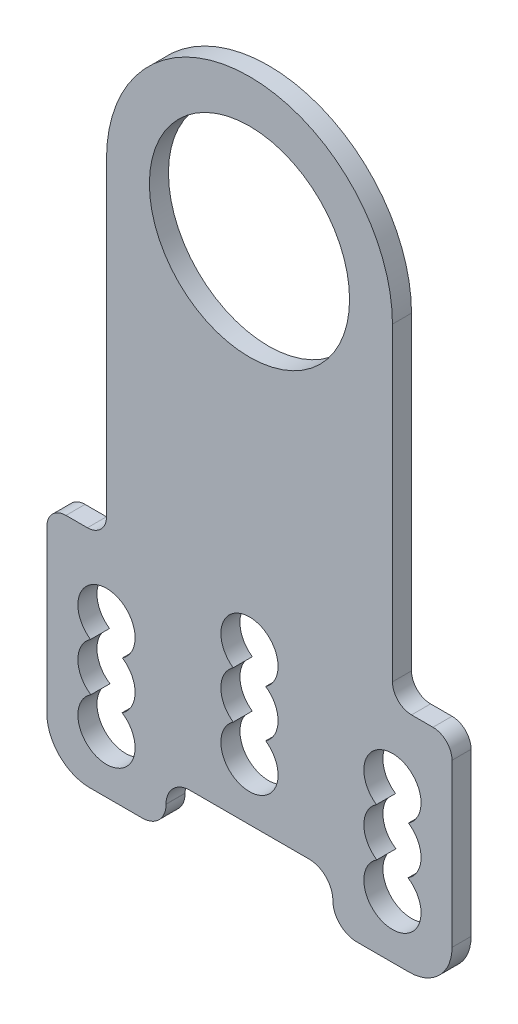
from build123d import *

# Parameters (mm, degrees)
SKETCH_1_R      = 10.5
EXTRUDE_1_DEPTH = 2


with BuildPart() as part:
    # 草图1 → 凸台-拉伸1 (new body)
    with BuildSketch(Plane.XY):
        with BuildLine():
            Line((-15, 0), (-15, -32.5))
            ThreePointArc((-15, -32.5), (-15.585786438, -33.914213562), (-17, -34.5))
            Line((-17, -34.5), (-19.25, -34.5))
            ThreePointArc((-19.25, -34.5), (-20.664213562, -35.085786438), (-21.25, -36.5))
            Line((-21.25, -36.5), (-21.25, -53.5))
            ThreePointArc((-21.25, -53.5), (-19.931980515, -56.681980515), (-16.75, -58))
            Line((-16.75, -58), (-11.25, -58))
            ThreePointArc((-11.25, -58), (-9.482233047, -57.267766953), (-8.75, -55.5))
            Line((-8.75, -55.5), (-8.75, -55.474127277))
            ThreePointArc((-8.75, -55.474127277), (-8.017766953, -53.706360324), (-6.25, -52.974127277))
            Line((-6.25, -52.974127277), (6.25, -52.974127277))
            ThreePointArc((6.25, -52.974127277), (8.017766953, -53.706360324), (8.75, -55.474127277))
            Line((8.75, -55.474127277), (8.75, -55.5))
            ThreePointArc((8.75, -55.5), (9.482233047, -57.267766953), (11.25, -58))
            Line((11.25, -58), (16.75, -58))
            ThreePointArc((16.75, -58), (19.931980515, -56.681980515), (21.25, -53.5))
            Line((21.25, -53.5), (21.25, -36.5))
            ThreePointArc((21.25, -36.5), (20.664213562, -35.085786438), (19.25, -34.5))
            Line((19.25, -34.5), (17, -34.5))
            ThreePointArc((17, -34.5), (15.585786438, -33.914213562), (15, -32.5))
            Line((15, -32.5), (15, 0))
            ThreePointArc((15, 0), (0, 15), (-15, 0))
        make_face()
        Circle(SKETCH_1_R, mode=Mode.SUBTRACT)
        with BuildLine():
            ThreePointArc((-16.638642988, -49.487063639), (-15, -55), (-13.361357012, -49.487063639))
            ThreePointArc((-13.361357012, -49.487063639), (-12.000091296, -46.997531654), (-13.322348529, -44.487063639))
            ThreePointArc((-13.322348529, -44.487063639), (-15, -39), (-16.677651471, -44.487063639))
            ThreePointArc((-16.677651471, -44.487063639), (-17.999908704, -46.997531654), (-16.638642988, -49.487063639))
        make_face(mode=Mode.SUBTRACT)
        with BuildLine():
            ThreePointArc((-1.704802234, -39.568531819), (-3, -42.037063639), (-1.704802234, -44.505595458))
            ThreePointArc((-1.704802234, -44.505595458), (0, -49.974127277), (1.704802234, -44.505595458))
            ThreePointArc((1.704802234, -44.505595458), (3, -42.037063639), (1.704802234, -39.568531819))
            ThreePointArc((1.704802234, -39.568531819), (0, -34.1), (-1.704802234, -39.568531819))
        make_face(mode=Mode.SUBTRACT)
        with BuildLine():
            ThreePointArc((13.361357012, -49.487063639), (15, -55), (16.638642988, -49.487063639))
            ThreePointArc((16.638642988, -49.487063639), (17.999908704, -46.997531654), (16.677651471, -44.487063639))
            ThreePointArc((16.677651471, -44.487063639), (15, -39), (13.322348529, -44.487063639))
            ThreePointArc((13.322348529, -44.487063639), (12.000091296, -46.997531654), (13.361357012, -49.487063639))
        make_face(mode=Mode.SUBTRACT)
    extrude(amount=EXTRUDE_1_DEPTH)


solid = part.part
